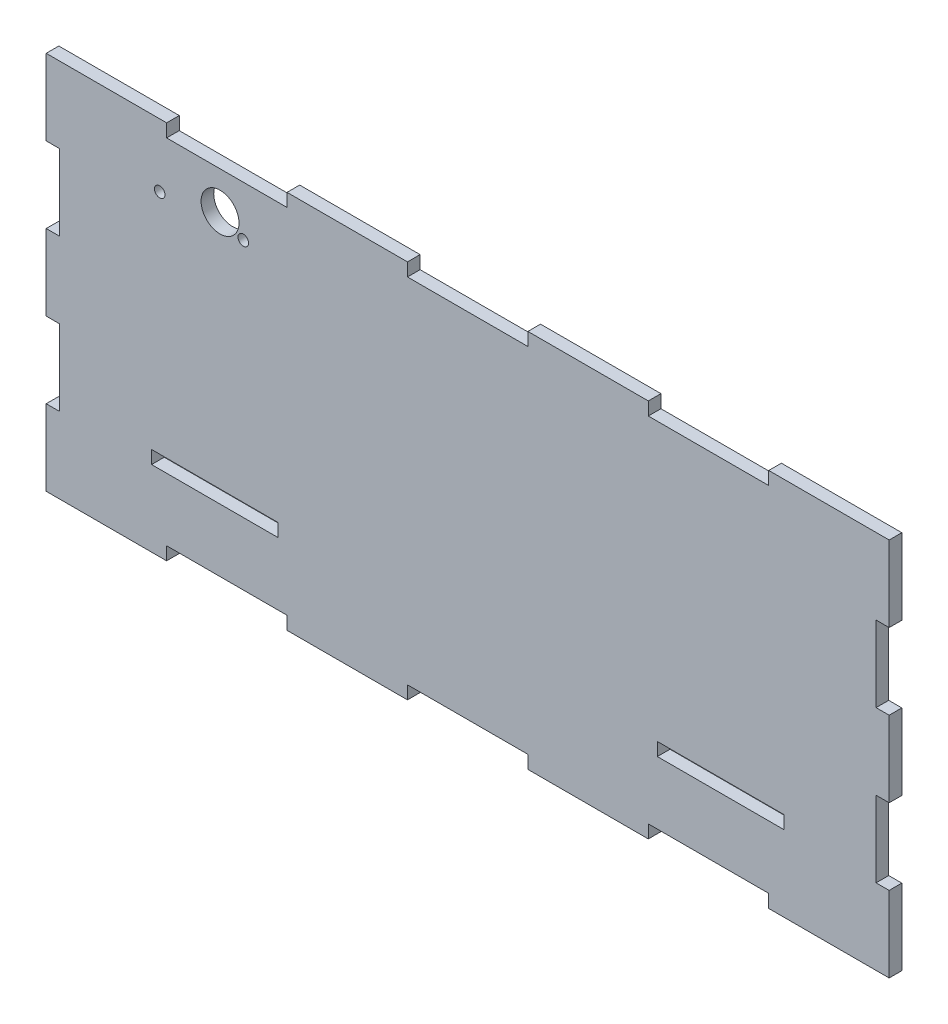
from build123d import *

# Parameters (mm, degrees)
SALIENTE_EXTRUIR1_DEPTH = 1.5
CROQUIS2_W              = 30
CROQUIS2_H              = 3.1
CORTAR_EXTRUIR1_DEPTH   = 10
CROQUIS6_R              = 1.25
CROQUIS6_R_2            = 4.5
CORTAR_EXTRUIR2_DEPTH   = 3


with BuildPart() as part:
    # Croquis1 → Saliente-Extruir1 (new, symmetric)
    with BuildSketch(Plane.XY):
        Polygon((-100, -27), (-100, -45), (-71.428571429, -45), (-71.428571429, -41.9), (-42.857142857, -41.9), (-42.857142857, -45), (-14.285714286, -45), (-14.285714286, -41.9), (14.285714286, -41.9), (14.285714286, -45), (42.857142857, -45), (42.857142857, -41.9), (71.428571429, -41.9), (71.428571429, -45), (100, -45), (100, -27), (96.9, -27), (96.9, -9), (100, -9), (100, 9), (96.9, 9), (96.9, 27), (100, 27), (100, 45), (71.428571429, 45), (71.428571429, 41.9), (42.857142857, 41.9), (42.857142857, 45), (14.285714286, 45), (14.285714286, 41.9), (-14.285714286, 41.9), (-14.285714286, 45), (-42.857142857, 45), (-42.857142857, 41.9), (-71.428571429, 41.9), (-71.428571429, 45), (-100, 45), (-100, 27), (-96.9, 27), (-96.9, 9), (-100, 9), (-100, -9), (-96.9, -9), (-96.9, -27), align=None)
    extrude(amount=SALIENTE_EXTRUIR1_DEPTH, both=True)

    # Croquis2 → Cortar-Extruir1 (cut)
    with BuildSketch(Plane.XY.offset(1.5)):
        with Locations((-60, -25.45)):
            Rectangle(CROQUIS2_W, CROQUIS2_H)
        with Locations((60, -25.45)):
            Rectangle(CROQUIS2_W, CROQUIS2_H)
    extrude(amount=-CORTAR_EXTRUIR1_DEPTH, mode=Mode.SUBTRACT)

    # Croquis6 → Cortar-Extruir2 (cut)
    with BuildSketch(Plane(origin=(0, 0, -1.5), x_dir=(-1, 0, 0), z_dir=(0, 0, -1))):
        with Locations((53.253279384, 30)):
            Circle(CROQUIS6_R)
        with Locations((73.053279384, 30)):
            Circle(CROQUIS6_R)
        with Locations((58.753279384, 33)):
            Circle(CROQUIS6_R_2)
    extrude(amount=-CORTAR_EXTRUIR2_DEPTH, mode=Mode.SUBTRACT)


solid = part.part
